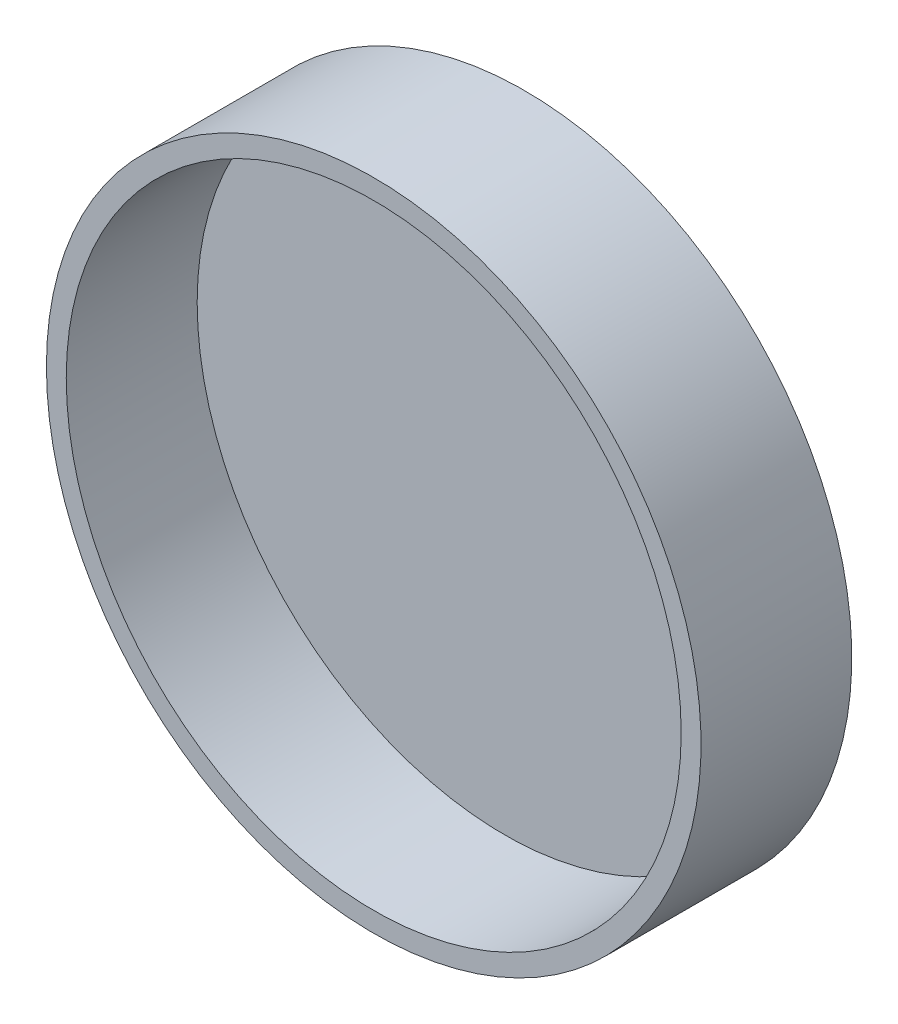
from build123d import *

# Parameters (mm, degrees)
SKETCH1_R           = 16.5
BOSS_EXTRUDE1_DEPTH = 7.6
SHELL1_T            = -1


with BuildPart() as part:
    # Sketch1 → Boss-Extrude1 (new body)
    with BuildSketch(Plane.XY):
        with Locations(Location((0, 0, 0), (0, 0, 180))):
            Circle(SKETCH1_R)
    extrude(amount=BOSS_EXTRUDE1_DEPTH)

    # Shell1
    shell1_openings = [part.faces().sort_by_distance(p)[0] for p in [
        (0, 0, 7.6),
    ]]
    offset(amount=SHELL1_T, openings=shell1_openings, kind=Kind.INTERSECTION)


solid = part.part
